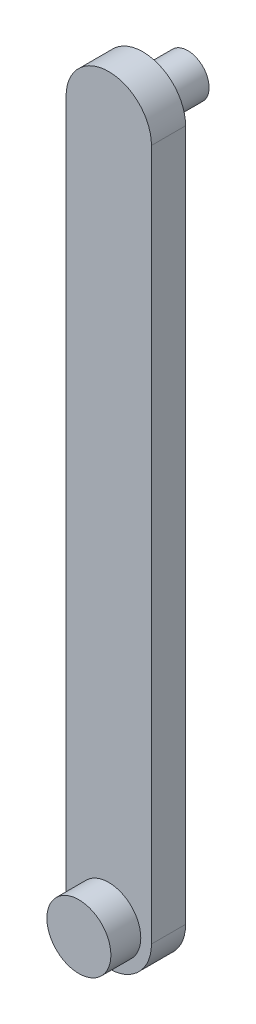
from build123d import *

# Parameters (mm, degrees)
SKETCH1_R           = 50
SKETCH1_R_2         = 75
BOSS_EXTRUDE1_DEPTH = 80
SKETCH1_2_R         = 75
BOSS_EXTRUDE2_DEPTH = 150
BOSS_EXTRUDE3_START = -105
SKETCH1_4_R         = 50
BOSS_EXTRUDE3_DEPTH = 185


with BuildPart() as part:
    # Sketch1 → Boss-Extrude1 (new body)
    with BuildSketch(Plane.XY):
        with BuildLine():
            Line((-100, 0), (-100, 1620))
            ThreePointArc((-100, 1620), (0, 1720), (100, 1620))
            Line((100, 1620), (100, 0))
            ThreePointArc((100, 0), (0, -100), (-100, 0))
        make_face()
        with Locations((0, 1620)):
            Circle(SKETCH1_R, mode=Mode.SUBTRACT)
        Circle(SKETCH1_R_2, mode=Mode.SUBTRACT)
    extrude(amount=BOSS_EXTRUDE1_DEPTH)

    # Sketch1<4> → Boss-Extrude3 (add)
    with BuildSketch(Plane.XY.offset(BOSS_EXTRUDE3_START)):
        with Locations((0, 1620)):
            Circle(SKETCH1_4_R)
    extrude(amount=BOSS_EXTRUDE3_DEPTH)


with BuildPart() as body_2:
    # Sketch1<2> → Boss-Extrude2 (new body)
    with BuildSketch(Plane.XY):
        Circle(SKETCH1_2_R)
    extrude(amount=BOSS_EXTRUDE2_DEPTH)


solid = Compound([part.part, body_2.part])
